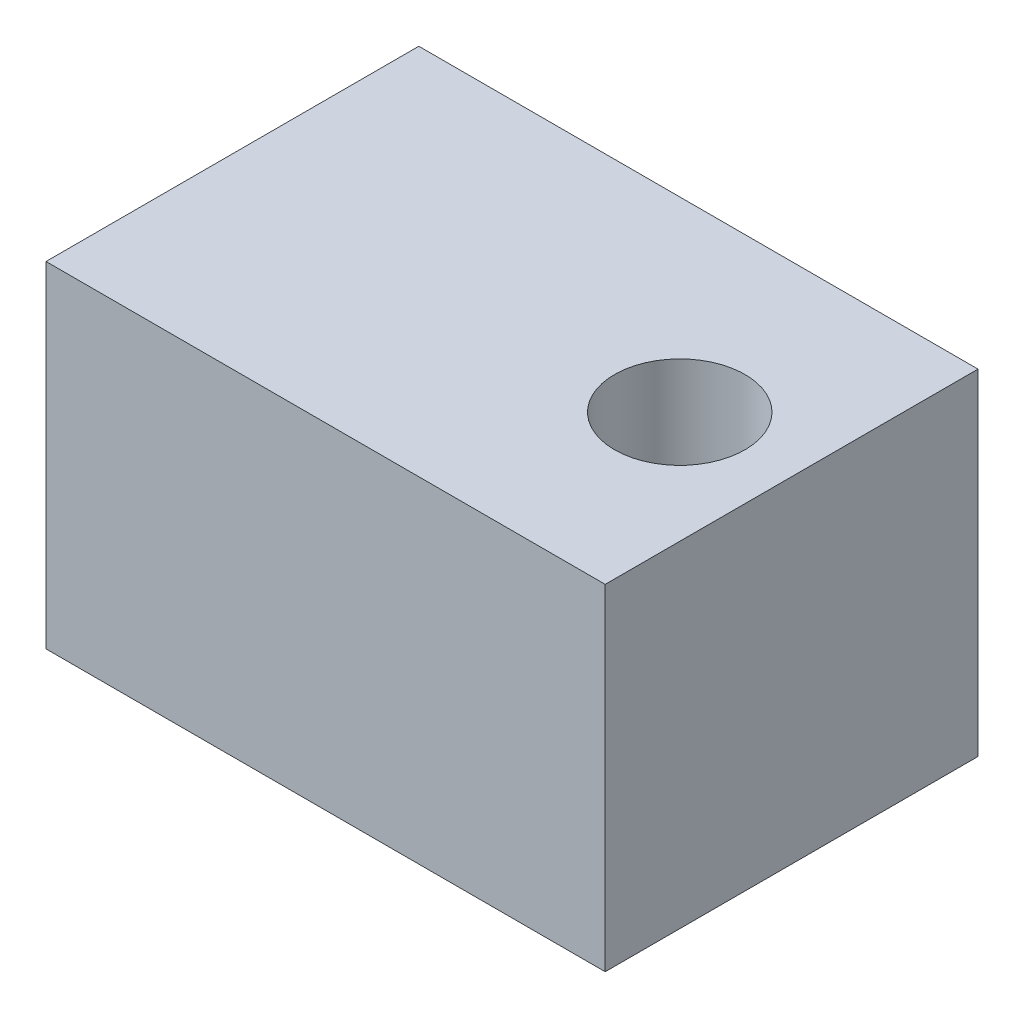
from build123d import *

# Parameters (mm, degrees)
SKETCH1_W           = 15
SKETCH1_H           = 10
BOSS_EXTRUDE1_DEPTH = 9
SKETCH3_R           = 1.75
CUT_EXTRUDE1_DEPTH  = 13.737739203


with BuildPart() as part:
    # Sketch1 → Boss-Extrude1 (new body)
    with BuildSketch(Plane(origin=(0, 0, 0), x_dir=(1, 0, 0), z_dir=(0, 1, 0))):
        Rectangle(SKETCH1_W, SKETCH1_H)
    extrude(amount=BOSS_EXTRUDE1_DEPTH)

    # Sketch3 → Cut-Extrude1 (cut, through all)
    with BuildSketch(Plane(origin=(0, 9, 0), x_dir=(1, 0, 0), z_dir=(0, 1, 0))):
        with Locations(Location((4.5, 0, 0), (0, 0, 270))):
            Circle(SKETCH3_R)
    extrude(amount=-CUT_EXTRUDE1_DEPTH, mode=Mode.SUBTRACT)


solid = part.part
